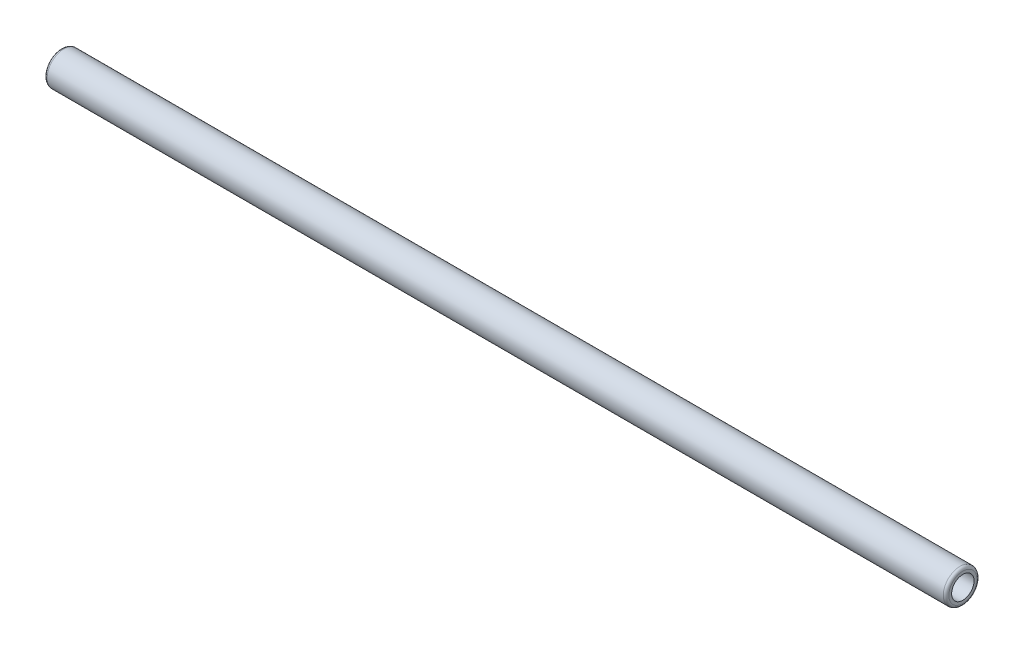
from build123d import *

# Parameters (mm, degrees)
SKETCH_1_R      = 3
SKETCH_1_R_2    = 2
EXTRUDE_1_DEPTH = 161
FILLET_1_R      = 0.5


with BuildPart() as part:
    # Эскиз1 → Бобышка-Вытянуть1 (new body)
    with BuildSketch(Plane(origin=(0, 0, 0), x_dir=(0, 0, -1), z_dir=(1, 0, 0))):
        Circle(SKETCH_1_R)
        Circle(SKETCH_1_R_2, mode=Mode.SUBTRACT)
    extrude(amount=EXTRUDE_1_DEPTH)

    # Скругление1
    fillet_1_edges = [part.edges().sort_by_distance(p)[0] for p in [
        (0, 0, 3),
        (161, 0, 3),
    ]]
    fillet(fillet_1_edges, radius=FILLET_1_R)


solid = part.part
